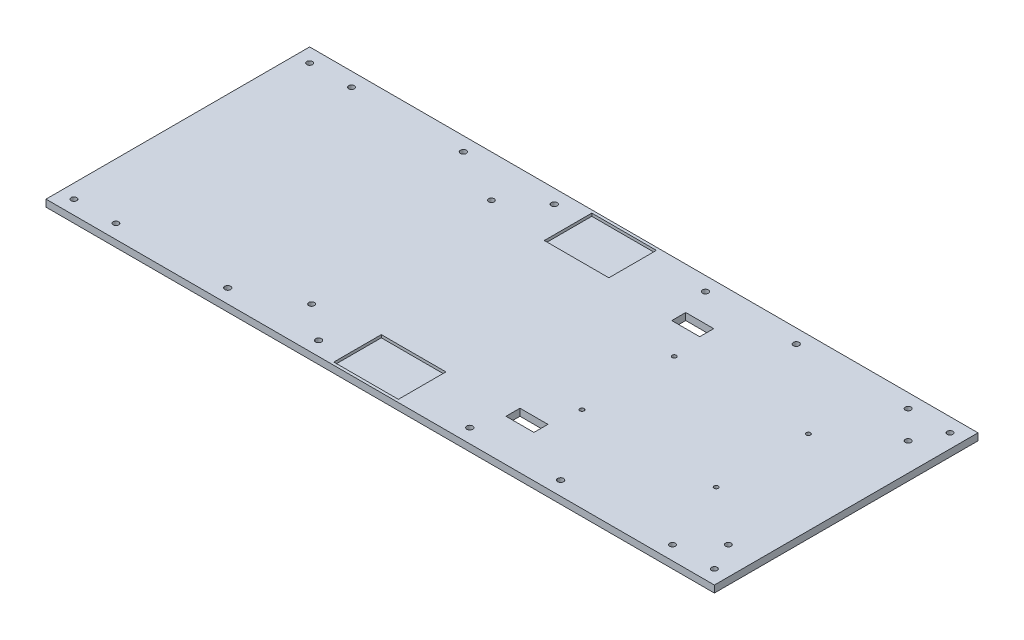
from build123d import *

# Parameters (mm, degrees)
ESQUISSE1_R             = 2
ESQUISSE1_W             = 20
ESQUISSE1_H             = 10
BOSS_EXTRU_4_DEPTH      = 5
ESQUISSE2_W             = 35.2
ESQUISSE2_H             = 34
ESQUISSE2_W_2           = 11
ENL_V_MAT_EXTRU_1_DEPTH = 2
ESQUISSE3_R             = 2
ENL_V_MAT_EXTRU_2_DEPTH = 5
ESQUISSE5_R             = 2.1
ENL_V_MAT_EXTRU_3_DEPTH = 10


with BuildPart() as part:
    # Esquisse1 → Boss.-Extru.4 (new body)
    with BuildSketch(Plane(origin=(0, 0, 0), x_dir=(1, 0, 0), z_dir=(0, 1, 0))):
        Polygon((405.236140528, 141.382140187), (246.159297522, 141.382140187), (-72.917545484, 141.382140187), (-72.917545484, -47.211568366), (246.159297522, -47.211568366), (405.236140528, -47.211568366), align=None)
        with Locations(Location((395.236140528, -37.211568366, 0), (0, 0, 270))):
            Circle(ESQUISSE1_R, mode=Mode.SUBTRACT)
        with Locations(Location((-62.917545484, -37.211568366, 0), (0, 0, 270))):
            Circle(ESQUISSE1_R, mode=Mode.SUBTRACT)
        with Locations(Location((-32.917545484, -37.211568366, 0), (0, 0, 270))):
            Circle(ESQUISSE1_R, mode=Mode.SUBTRACT)
        with Locations((236.159297522, -12.211568366)):
            Rectangle(ESQUISSE1_W, ESQUISSE1_H, mode=Mode.SUBTRACT)
        with Locations(Location((365.236140528, -37.211568366, 0), (0, 0, 270))):
            Circle(ESQUISSE1_R, mode=Mode.SUBTRACT)
        with Locations(Location((-62.917545484, 131.382140187, 0), (0, 0, 270))):
            Circle(ESQUISSE1_R, mode=Mode.SUBTRACT)
        with Locations(Location((-32.917545484, 131.382140187, 0), (0, 0, 270))):
            Circle(ESQUISSE1_R, mode=Mode.SUBTRACT)
        with Locations((236.159297522, 106.382140187)):
            Rectangle(ESQUISSE1_W, ESQUISSE1_H, mode=Mode.SUBTRACT)
        with Locations(Location((365.236140528, 131.382140187, 0), (0, 0, 270))):
            Circle(ESQUISSE1_R, mode=Mode.SUBTRACT)
        with Locations(Location((395.236140528, 131.382140187, 0), (0, 0, 270))):
            Circle(ESQUISSE1_R, mode=Mode.SUBTRACT)
    extrude(amount=BOSS_EXTRU_4_DEPTH)

    # Esquisse2 → Enlèv. mat.-Extru.1 (cut)
    with BuildSketch(Plane(origin=(0, 5, 0), x_dir=(1, 0, 0), z_dir=(0, 1, 0))):
        with Locations((148.559297522, 122.382140187)):
            Rectangle(ESQUISSE2_W, ESQUISSE2_H)
        with Locations((171.659297522, 122.382140187)):
            Rectangle(ESQUISSE2_W_2, ESQUISSE2_H)
        with Locations((148.559297522, -28.211568366)):
            Rectangle(ESQUISSE2_W, ESQUISSE2_H)
        with Locations((171.659297522, -28.211568366)):
            Rectangle(ESQUISSE2_W_2, ESQUISSE2_H)
    extrude(amount=-ENL_V_MAT_EXTRU_1_DEPTH, mode=Mode.SUBTRACT)

    # Esquisse3 → Enlèv. mat.-Extru.2 (cut)
    with BuildSketch(Plane.XZ):
        with BuildLine():
            ThreePointArc((387.236140528, -111.382140187), (383.821926965, -109.967926625), (385.236140528, -113.382140187))
            Line((385.236140528, -113.382140187), (385.236140528, -111.382140187))
            Line((385.236140528, -111.382140187), (387.236140528, -111.382140187))
        make_face()
        with BuildLine():
            Line((385.236140528, -111.382140187), (385.236140528, -113.382140187))
            ThreePointArc((385.236140528, -113.382140187), (386.65035409, -112.79635375), (387.236140528, -111.382140187))
            Line((387.236140528, -111.382140187), (385.236140528, -111.382140187))
        make_face()
        with BuildLine():
            ThreePointArc((387.236140528, 17.211568366), (386.65035409, 18.625781928), (385.236140528, 19.211568366))
            Line((385.236140528, 19.211568366), (385.236140528, 17.211568366))
            Line((385.236140528, 17.211568366), (387.236140528, 17.211568366))
        make_face()
        with BuildLine():
            Line((385.236140528, 17.211568366), (385.236140528, 19.211568366))
            ThreePointArc((385.236140528, 19.211568366), (383.821926965, 15.797354804), (387.236140528, 17.211568366))
            Line((387.236140528, 17.211568366), (385.236140528, 17.211568366))
        make_face()
        with BuildLine():
            ThreePointArc((346.736140528, -80.085285911), (346.296800699, -79.024625739), (345.236140528, -78.585285911))
            Line((345.236140528, -78.585285911), (345.236140528, -80.085285911))
            Line((345.236140528, -80.085285911), (343.736140528, -80.085285911))
            ThreePointArc((343.736140528, -80.085285911), (345.236140528, -81.585285911), (346.736140528, -80.085285911))
        make_face()
        with BuildLine():
            Line((345.236140528, -80.085285911), (345.236140528, -78.585285911))
            ThreePointArc((345.236140528, -78.585285911), (344.175480356, -79.024625739), (343.736140528, -80.085285911))
            Line((343.736140528, -80.085285911), (345.236140528, -80.085285911))
        make_face()
        with BuildLine():
            ThreePointArc((343.736140528, -14.085285911), (344.175480356, -15.145946082), (345.236140528, -15.585285911))
            Line((345.236140528, -15.585285911), (345.236140528, -14.085285911))
            Line((345.236140528, -14.085285911), (343.736140528, -14.085285911))
        make_face()
        with BuildLine():
            Line((345.236140528, -14.085285911), (345.236140528, -15.585285911))
            ThreePointArc((345.236140528, -15.585285911), (346.296800699, -15.145946082), (346.736140528, -14.085285911))
            ThreePointArc((346.736140528, -14.085285911), (345.236140528, -12.585285911), (343.736140528, -14.085285911))
            Line((343.736140528, -14.085285911), (345.236140528, -14.085285911))
        make_face()
        with BuildLine():
            ThreePointArc((249.236140528, -15.585285911), (250.296800699, -15.145946082), (250.736140528, -14.085285911))
            Line((250.736140528, -14.085285911), (249.236140528, -14.085285911))
            Line((249.236140528, -14.085285911), (249.236140528, -15.585285911))
        make_face()
        with BuildLine():
            Line((249.236140528, -14.085285911), (250.736140528, -14.085285911))
            ThreePointArc((250.736140528, -14.085285911), (248.175480356, -13.024625739), (249.236140528, -15.585285911))
            Line((249.236140528, -15.585285911), (249.236140528, -14.085285911))
        make_face()
        with BuildLine():
            ThreePointArc((249.236140528, -78.585285911), (248.175480356, -81.145946082), (250.736140528, -80.085285911))
            Line((250.736140528, -80.085285911), (249.236140528, -80.085285911))
            Line((249.236140528, -80.085285911), (249.236140528, -78.585285911))
        make_face()
        with BuildLine():
            Line((249.236140528, -80.085285911), (250.736140528, -80.085285911))
            ThreePointArc((250.736140528, -80.085285911), (250.296800699, -79.024625739), (249.236140528, -78.585285911))
            Line((249.236140528, -78.585285911), (249.236140528, -80.085285911))
        make_face()
        with BuildLine():
            ThreePointArc((87.082454516, 19.211568366), (85.668240954, 18.625781928), (85.082454516, 17.211568366))
            Line((85.082454516, 17.211568366), (87.082454516, 17.211568366))
            Line((87.082454516, 17.211568366), (87.082454516, 19.211568366))
        make_face()
        with BuildLine():
            Line((87.082454516, 17.211568366), (85.082454516, 17.211568366))
            ThreePointArc((85.082454516, 17.211568366), (87.082454516, 15.211568366), (89.082454516, 17.211568366))
            ThreePointArc((89.082454516, 17.211568366), (88.496668078, 18.625781928), (87.082454516, 19.211568366))
            Line((87.082454516, 19.211568366), (87.082454516, 17.211568366))
        make_face()
        with Locations(Location((87.082454516, -111.382140187, 0), (0, 0, 270))):
            Circle(ESQUISSE3_R)
    extrude(amount=-ENL_V_MAT_EXTRU_2_DEPTH, mode=Mode.SUBTRACT)

    # Esquisse5 → Enlèv. mat.-Extru.3 (cut)
    with BuildSketch(Plane(origin=(0, 5, 0), x_dir=(1, 0, 0), z_dir=(0, 1, 0))):
        with Locations(Location((285.236140528, 131.382140187, 0), (0, 0, 270))):
            Circle(ESQUISSE5_R)
        with Locations(Location((285.236140528, -37.211568366, 0), (0, 0, 270))):
            Circle(ESQUISSE5_R)
        with Locations(Location((47.082454516, 131.382140187, 0), (0, 0, 270))):
            Circle(ESQUISSE5_R)
        with Locations(Location((47.082454516, -37.211568366, 0), (0, 0, 270))):
            Circle(ESQUISSE5_R)
        with Locations(Location((220.236140528, 131.382140187, 0), (0, 0, 270))):
            Circle(ESQUISSE5_R)
        with Locations(Location((220.236140528, -37.211568366, 0), (0, 0, 270))):
            Circle(ESQUISSE5_R)
        with Locations(Location((112.082454516, 131.382140187, 0), (0, 0, 270))):
            Circle(ESQUISSE5_R)
        with Locations(Location((112.082454516, -37.211568366, 0), (0, 0, 270))):
            Circle(ESQUISSE5_R)
    extrude(amount=-ENL_V_MAT_EXTRU_3_DEPTH, mode=Mode.SUBTRACT)


solid = part.part
